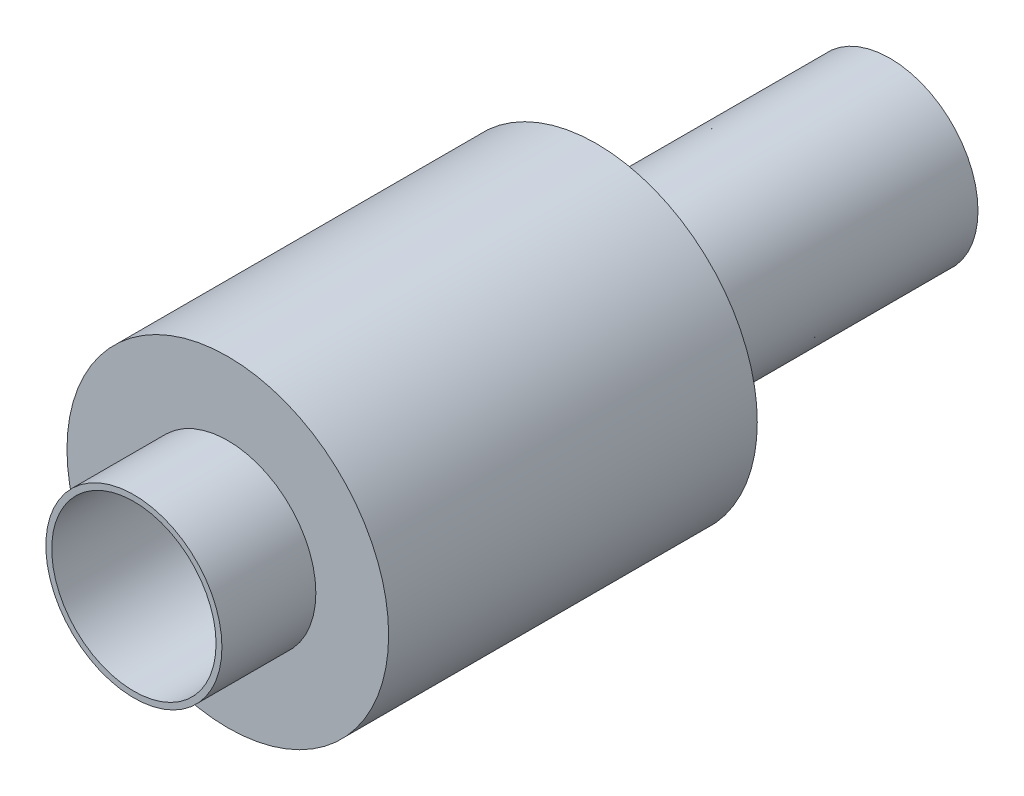
from build123d import *

# Parameters (mm, degrees)
SKETCH1_R           = 17.399
BOSS_EXTRUDE1_DEPTH = 50.038
SKETCH3_R           = 38.1
SKETCH3_R_2         = 9.525
CUT_EXTRUDE1_DEPTH  = 10.16
SKETCH4_R           = 8.89
CUT_EXTRUDE2_DEPTH  = 127
SKETCH5_R           = 9.525
SKETCH5_R_2         = 8.89
BOSS_EXTRUDE2_DEPTH = 31.75


with BuildPart() as part:
    # Sketch1 → Boss-Extrude1 (new body)
    with BuildSketch(Plane.XY):
        Circle(SKETCH1_R)
    extrude(amount=BOSS_EXTRUDE1_DEPTH)

    # Sketch3 → Cut-Extrude1 (cut)
    with BuildSketch(Plane.XY.offset(50.038)):
        Circle(SKETCH3_R)
        Circle(SKETCH3_R_2, mode=Mode.SUBTRACT)
    extrude(amount=-CUT_EXTRUDE1_DEPTH, mode=Mode.SUBTRACT)

    # Sketch4 → Cut-Extrude2 (cut)
    with BuildSketch(Plane.XY.offset(50.038)):
        Circle(SKETCH4_R)
    extrude(amount=-CUT_EXTRUDE2_DEPTH, mode=Mode.SUBTRACT)

    # Sketch5 → Boss-Extrude2 (add)
    with BuildSketch(Plane(origin=(0, 0, 0), x_dir=(-1, 0, 0), z_dir=(0, 0, -1))):
        with Locations(Location((0, 0, 0), (0, 0, 180))):
            Circle(SKETCH5_R)
        with Locations(Location((0, 0, 0), (0, 0, 180))):
            Circle(SKETCH5_R_2, mode=Mode.SUBTRACT)
    extrude(amount=BOSS_EXTRUDE2_DEPTH)


solid = part.part
